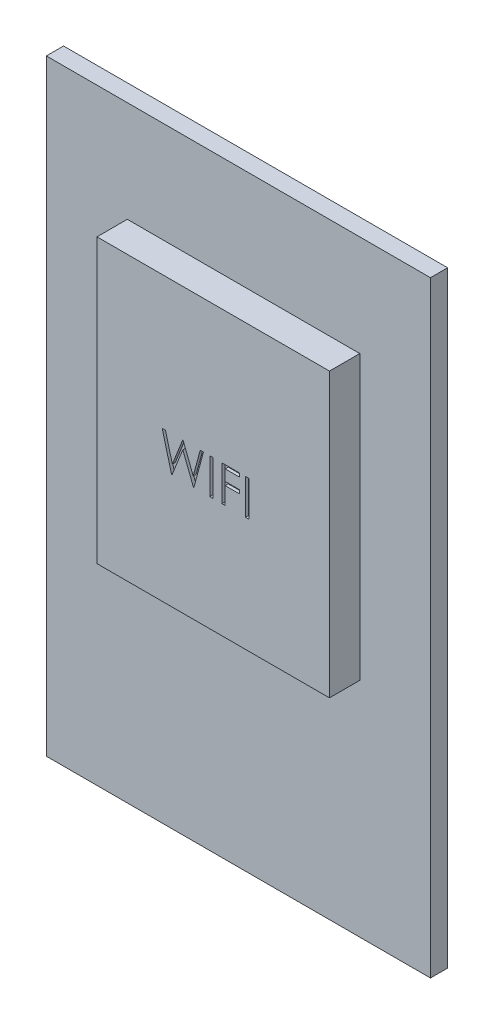
from build123d import *

# Parameters (mm, degrees)
SKETCH1_W           = 38
SKETCH1_H           = 60
BOSS_EXTRUDE1_DEPTH = 1.7
SKETCH3_W           = 23
SKETCH3_H           = 28
BOSS_EXTRUDE2_DEPTH = 3
SKETCH4_W           = 0.314102564
SKETCH4_H           = 3.5
CUT_EXTRUDE2_DEPTH  = 0.3


with BuildPart() as part:
    # Sketch1 → Boss-Extrude1 (new body)
    with BuildSketch(Plane.XY):
        Rectangle(SKETCH1_W, SKETCH1_H)
    extrude(amount=BOSS_EXTRUDE1_DEPTH)

    # Sketch3 → Boss-Extrude2 (add)
    with BuildSketch(Plane.XY.offset(1.7)):
        with Locations((0.506757991, 6.004364017)):
            Rectangle(SKETCH3_W, SKETCH3_H)
    extrude(amount=BOSS_EXTRUDE2_DEPTH)

    # Sketch4 → Cut-Extrude2 (cut)
    with BuildSketch(Plane.XY.offset(4.7)):
        Polygon((-4.543396912, 6.825557411), (-4.218777521, 6.825557411), (-3.533781527, 4.25875052), (-2.515051559, 6.825557411), (-2.469478643, 6.825557411), (-1.469678963, 4.276278565), (-0.781177361, 6.825557411), (-0.460063578, 6.825557411), (-1.403773514, 3.325557411), (-1.448645309, 3.325557411), (-2.501730245, 6.002440424), (-3.567435373, 3.325557411), (-3.612307168, 3.325557411), align=None)
        with Locations((0.325192832, 5.075557411)):
            Rectangle(SKETCH4_W, SKETCH4_H)
        Polygon((1.379680011, 6.825557411), (3.084808216, 6.825557411), (3.084808216, 6.466583052), (1.693782575, 6.466583052), (1.693782575, 5.389659975), (3.084808216, 5.389659975), (3.084808216, 5.030685616), (1.693782575, 5.030685616), (1.693782575, 3.325557411), (1.379680011, 3.325557411), align=None)
        with Locations((3.870064627, 5.075557411)):
            Rectangle(SKETCH4_W, SKETCH4_H)
    extrude(amount=-CUT_EXTRUDE2_DEPTH, mode=Mode.SUBTRACT)


solid = part.part
